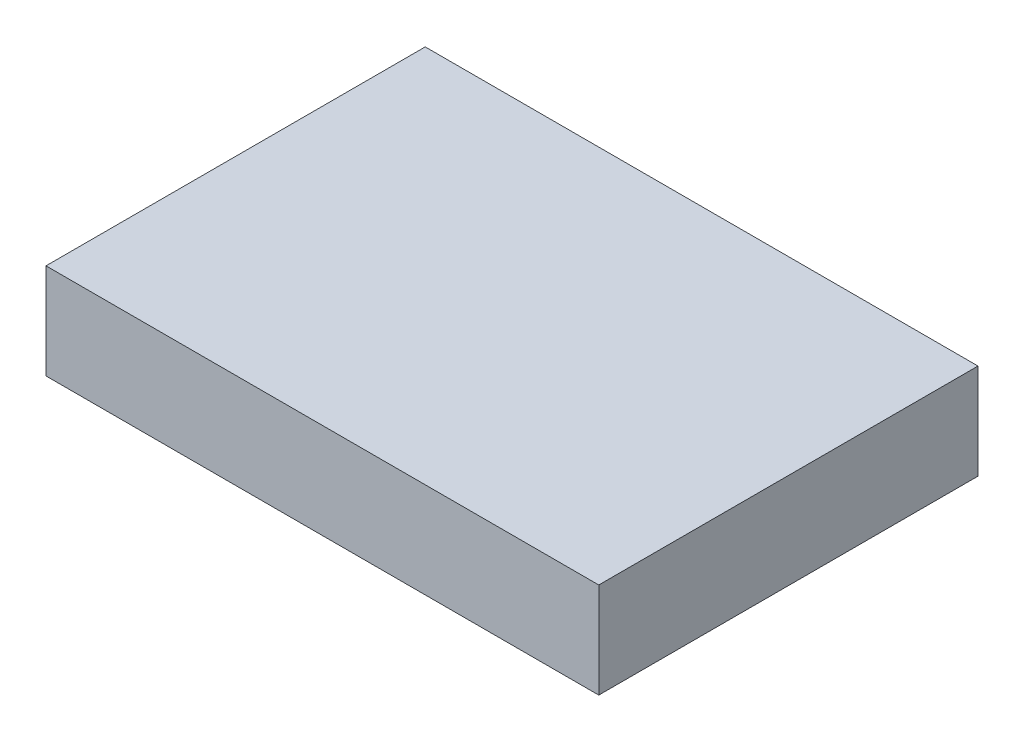
from build123d import *

# Parameters (mm, degrees)
SKETCH6_W      = 147.191865544
SKETCH6_H      = 100.979479207
EXTRUDE1_DEPTH = 25.4


with BuildPart() as part:
    # Sketch6 → Extrude1 (new body)
    with BuildSketch(Plane(origin=(0, 0, 0), x_dir=(1, 0, 0), z_dir=(0, 1, 0))):
        with Locations((73.595932772, 50.489739604)):
            Rectangle(SKETCH6_W, SKETCH6_H)
    extrude(amount=EXTRUDE1_DEPTH)


solid = part.part
